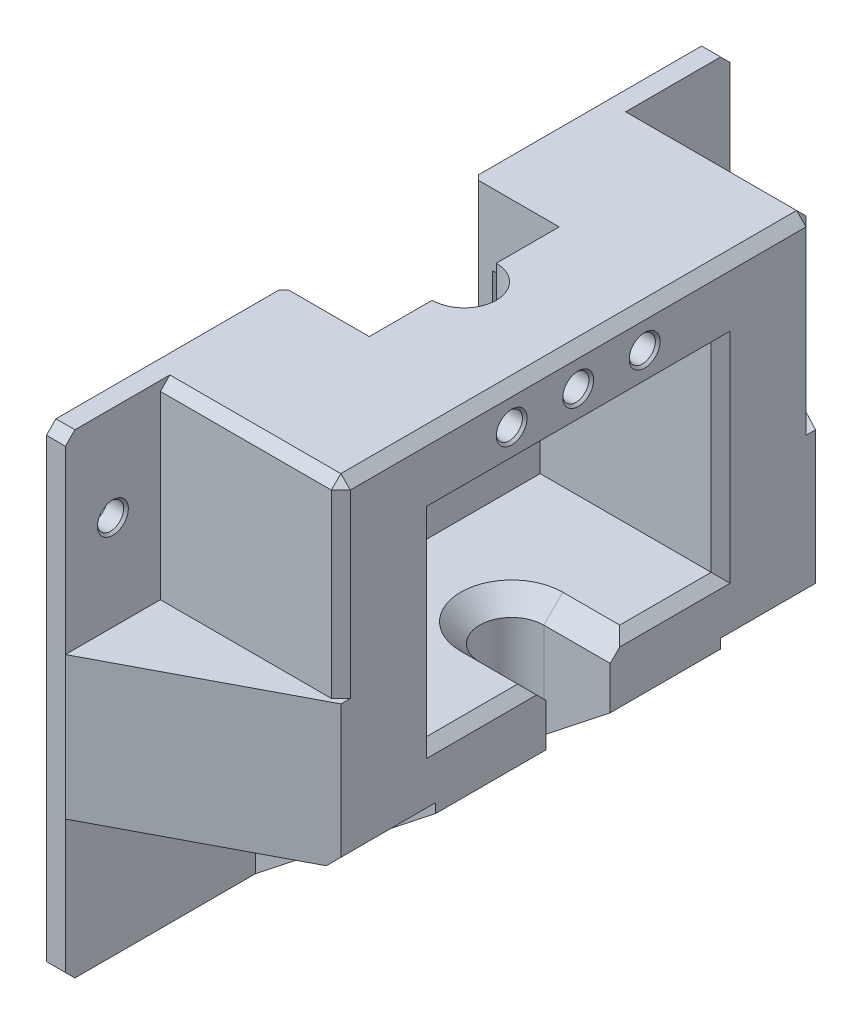
from build123d import *

# Parameters (mm, degrees)
SKETCH_1_W          = 140
SKETCH_1_H          = 100
EXTRUDE_1_DEPTH     = 4
SKETCH_9_R          = 2.75
CUT_EXTRUDE_3_DEPTH = 8
CHAMFER_2_SIZE      = 2
SKETCH_11_W         = 40
SKETCH_11_H         = 50
CUT_EXTRUDE_5_DEPTH = 5
SKETCH_12_W         = 10
SKETCH_12_H         = 15
EXTRUDE_2_DEPTH     = 14
SKETCH_13_W         = 60
SKETCH_13_H         = 15
EXTRUDE_3_DEPTH     = 14
SKETCH_14_W         = 28
SKETCH_14_H         = 70
EXTRUDE_4_DEPTH     = 20
SKETCH_15_W         = 28
SKETCH_15_H         = 70
EXTRUDE_5_DEPTH     = 20
SKETCH_16_R         = 6.75
CUT_EXTRUDE_6_DEPTH = 20
EXTRUDE_6_DEPTH     = 10
SKETCH_18_R         = 2.75
CUT_EXTRUDE_7_DEPTH = 96.268042911
SKETCH_19_R         = 2.75
CUT_EXTRUDE_8_DEPTH = 100
CHAMFER_3_SIZE      = 0.5
EXTRUDE_7_DEPTH     = 20
EXTRUDE_8_DEPTH     = 20
EXTRUDE_9_DEPTH     = 60
EXTRUDE_10_DEPTH    = 30
CHAMFER_4_SIZE      = 0.5
CHAMFER_5_SIZE      = 2
CHAMFER_6_SIZE      = 2
CHAMFER_7_SIZE      = 1
CUT_EXTRUDE_9_DEPTH = 100.564049794
CHAMFER_8_SIZE      = 4


with BuildPart() as part:
    # 草图1 → 凸台-拉伸1 (new body)
    with BuildSketch(Plane(origin=(0, 0, 0), x_dir=(0, 0, -1), z_dir=(1, 0, 0))):
        with Locations((0, -10)):
            Rectangle(SKETCH_1_W, SKETCH_1_H)
    extrude(amount=EXTRUDE_1_DEPTH)

    # 草图9 → 切除-拉伸3 (cut)
    with BuildSketch(Plane(origin=(4, 0, 0), x_dir=(0, 0, -1), z_dir=(1, 0, 0))):
        with Locations((-60, 20)):
            Circle(SKETCH_9_R)
        with Locations((60, 20)):
            Circle(SKETCH_9_R)
        with Locations((-45, -40)):
            Circle(SKETCH_9_R)
        with Locations((45, -40)):
            Circle(SKETCH_9_R)
    extrude(amount=-CUT_EXTRUDE_3_DEPTH, mode=Mode.SUBTRACT)

    # 倒角2
    chamfer_2_edges = [part.edges().sort_by_distance(p)[0] for p in [
        (2, 40, 70),
        (2, 40, -70),
        (2, -60, -70),
        (2, -60, 70),
    ]]
    chamfer(chamfer_2_edges, length=CHAMFER_2_SIZE)

    # 草图11 → 切除-拉伸5 (cut)
    with BuildSketch(Plane(origin=(4, 0, 0), x_dir=(0, 0, -1), z_dir=(1, 0, 0))):
        with Locations((0, 15)):
            Rectangle(SKETCH_11_W, SKETCH_11_H)
    extrude(amount=-CUT_EXTRUDE_5_DEPTH, mode=Mode.SUBTRACT)

    # 草图12 → 凸台-拉伸2 (add)
    with BuildSketch(Plane(origin=(4, 0, 0), x_dir=(0, 0, -1), z_dir=(1, 0, 0))):
        with Locations((-25, 32.5)):
            Rectangle(SKETCH_12_W, SKETCH_12_H)
        with Locations((25, 32.5)):
            Rectangle(SKETCH_12_W, SKETCH_12_H)
    extrude(amount=EXTRUDE_2_DEPTH)

    # 草图13 → 凸台-拉伸3 (add)
    with BuildSketch(Plane(origin=(18, 0, 0), x_dir=(0, 0, -1), z_dir=(1, 0, 0))):
        with Locations((0, 32.5)):
            Rectangle(SKETCH_13_W, SKETCH_13_H)
    extrude(amount=EXTRUDE_3_DEPTH)

    # 草图14 → 凸台-拉伸4 (add)
    with BuildSketch(Plane.XY.offset(30)):
        with Locations((18, 5)):
            Rectangle(SKETCH_14_W, SKETCH_14_H)
    extrude(amount=EXTRUDE_4_DEPTH)

    # 草图15 → 凸台-拉伸5 (add)
    with BuildSketch(Plane(origin=(0, 0, -30), x_dir=(-1, 0, 0), z_dir=(0, 0, -1))):
        with Locations((-18, 5)):
            Rectangle(SKETCH_15_W, SKETCH_15_H)
    extrude(amount=EXTRUDE_5_DEPTH)

    # 草图16 → 切除-拉伸6 (cut)
    with BuildSketch(Plane(origin=(0, 40, 0), x_dir=(1, 0, 0), z_dir=(0, 1, 0))):
        with Locations((18, 0)):
            Circle(SKETCH_16_R)
    extrude(amount=-CUT_EXTRUDE_6_DEPTH, mode=Mode.SUBTRACT)

    # 草图17 → 凸台-拉伸6 (add)
    with BuildSketch(Plane(origin=(32, 0, 0), x_dir=(0, 0, -1), z_dir=(1, 0, 0))):
        Polygon((50, 40), (-50, 40), (-50, -30), (-30, -30), (-30, 25), (30, 25), (30, -30), (50, -30), align=None)
    extrude(amount=EXTRUDE_6_DEPTH)

    # 草图18 → 切除-拉伸7 (cut, through all)
    with BuildSketch(Plane.ZY.offset(-18)):
        with Locations((14, 32.5)):
            Circle(SKETCH_18_R)
        with Locations((-14, 32.5)):
            Circle(SKETCH_18_R)
    extrude(amount=-CUT_EXTRUDE_7_DEPTH, mode=Mode.SUBTRACT)

    # 草图19 → 切除-拉伸8 (cut)
    with BuildSketch(Plane(origin=(42, 0, 0), x_dir=(0, 0, -1), z_dir=(1, 0, 0))):
        with Locations((0, 32.5)):
            Circle(SKETCH_19_R)
    extrude(amount=-CUT_EXTRUDE_8_DEPTH, mode=Mode.SUBTRACT)

    # 倒角3
    chamfer_3_edges = [part.edges().sort_by_distance(p)[0] for p in [
        (4, 20, 62.75),
        (4, -40, -42.25),
        (4, -40, 47.75),
        (4, 20, -57.25),
    ]]
    chamfer(chamfer_3_edges, length=CHAMFER_3_SIZE)

    # 草图20 → 凸台-拉伸7 (add)
    with BuildSketch(Plane.XY.offset(50)):
        Polygon((42, 25), (4, -30), (32, 25), align=None)
    extrude(amount=-EXTRUDE_7_DEPTH)

    # 草图21 → 凸台-拉伸8 (add)
    with BuildSketch(Plane(origin=(0, 0, -50), x_dir=(-1, 0, 0), z_dir=(0, 0, -1))):
        Polygon((-42, 25), (-4, -30), (-32, 25), align=None)
    extrude(amount=-EXTRUDE_8_DEPTH)

    # 草图22 → 凸台-拉伸9 (add)
    with BuildSketch(Plane.XY.offset(-30)):
        Polygon((42, -17), (4, -17), (4, -60), (42, -30), align=None)
    extrude(amount=EXTRUDE_9_DEPTH)

    # 草图23 → 凸台-拉伸10 (add)
    with BuildSketch(Plane.XZ.offset(30)):
        Polygon((42, 50), (4, 70), (4, 50), align=None)
    extrude_10 = extrude(amount=-EXTRUDE_10_DEPTH)

    # 镜向1: 凸台-拉伸10 across plane
    add(extrude_10.mirror(Plane.XY))

    # 倒角4
    chamfer_4_edges = [part.edges().sort_by_distance(p)[0] for p in [
        (42, 32.5, 11.25),
        (42, 32.5, -16.75),
        (42, 32.5, 2.75),
    ]]
    chamfer(chamfer_4_edges, length=CHAMFER_4_SIZE)

    # 倒角5
    chamfer_5_edges = [part.edges().sort_by_distance(p)[0] for p in [
        (42, 25, 0),
        (42, 4, -30),
        (42, 4, 30),
        (42, -17, 0),
    ]]
    chamfer(chamfer_5_edges, length=CHAMFER_5_SIZE)

    # 倒角6
    chamfer_6_edges = [part.edges().sort_by_distance(p)[0] for p in [
        (42, -30, 40),
        (42, -30, -40),
        (42, 20, 50),
        (42, 20, -50),
        (23, 40, -50),
        (42, 40, 0),
        (23, 40, 50),
    ]]
    chamfer(chamfer_6_edges, length=CHAMFER_6_SIZE)

    # 倒角7
    chamfer_7_edges = [part.edges().sort_by_distance(p)[0] for p in [
        (0, -10, 0),
        (0, 15, -20),
        (0, 15, 20),
    ]]
    chamfer(chamfer_7_edges, length=CHAMFER_7_SIZE)

    # 草图24 → 切除-拉伸9 (cut, through all)
    with BuildSketch(Plane(origin=(0, -17, 0), x_dir=(1, 0, 0), z_dir=(0, 1, 0))):
        with BuildLine():
            Line((28, 6.75), (43.669106449, 6.75))
            Line((43.669106449, 6.75), (43.669106449, -6.75))
            Line((43.669106449, -6.75), (28, -6.75))
            ThreePointArc((28, -6.75), (21.25, 0), (28, 6.75))
        make_face()
    extrude(amount=-CUT_EXTRUDE_9_DEPTH, mode=Mode.SUBTRACT)

    # 倒角8
    chamfer_8_edges = [part.edges().sort_by_distance(p)[0] for p in [
        (34, -17, -6.75),
        (34, -17, 6.75),
        (21.25, -17, 0),
    ]]
    chamfer(chamfer_8_edges, length=CHAMFER_8_SIZE)


solid = part.part
